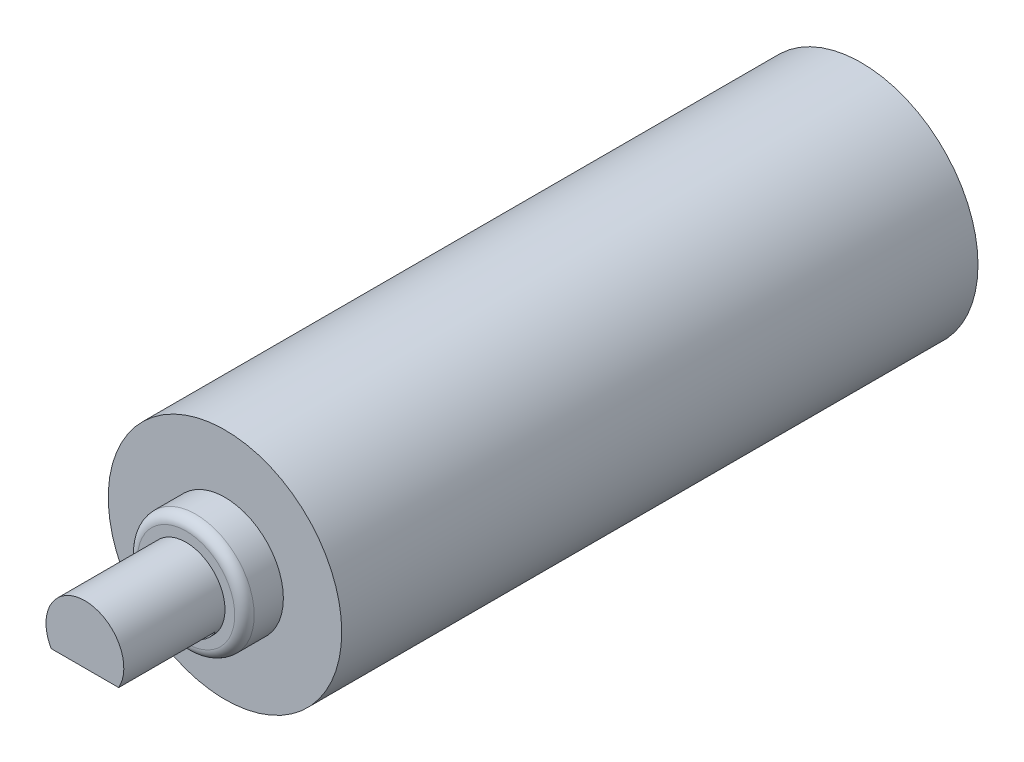
from build123d import *

# Parameters (mm, degrees)
SKETCH_1_R          = 3
EXTRUDE_1_DEPTH     = 16.35
SKETCH_2_R          = 1.5
EXTRUDE_2_DEPTH     = 1
SKETCH_3_R          = 1
EXTRUDE_3_DEPTH     = 2.6
CUT_EXTRUDE_1_DEPTH = 2.5
FILLET_1_R          = 0.25


with BuildPart() as part:
    # 草图1 → 凸台-拉伸1 (new body)
    with BuildSketch(Plane.XY):
        Circle(SKETCH_1_R)
    extrude(amount=-EXTRUDE_1_DEPTH)

    # 草图2 → 凸台-拉伸2 (add)
    with BuildSketch(Plane.XY):
        Circle(SKETCH_2_R)
    extrude(amount=EXTRUDE_2_DEPTH)

    # 草图3 → 凸台-拉伸3 (add)
    with BuildSketch(Plane.XY.offset(1)):
        Circle(SKETCH_3_R)
    extrude(amount=EXTRUDE_3_DEPTH)

    # 草图4 → 切除-拉伸1 (cut)
    with BuildSketch(Plane.XY.offset(3.6)):
        Polygon((0, -0.5), (0.862464595, -0.5), (0.862464595, -1), (0, -1), (-0.86936686, -1), (-0.86936686, -0.5), align=None)
    extrude(amount=-CUT_EXTRUDE_1_DEPTH, mode=Mode.SUBTRACT)

    # 圆角1
    fillet_1_edges = [part.edges().sort_by_distance(p)[0] for p in [
        (-1.5, 0, 1),
    ]]
    fillet(fillet_1_edges, radius=FILLET_1_R)


solid = part.part
